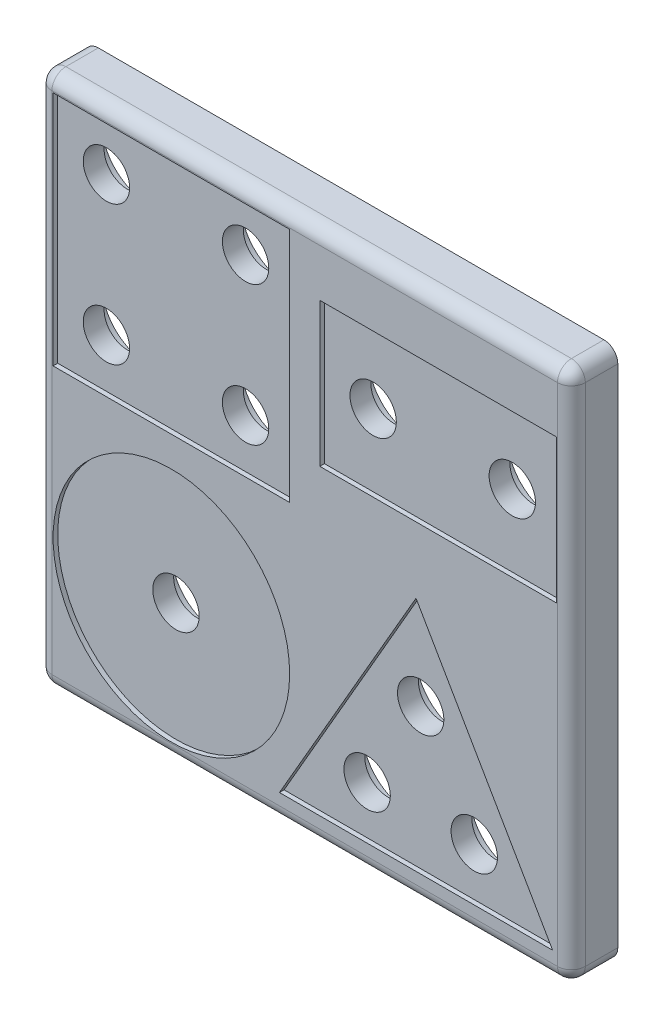
from build123d import *

# Parameters (mm, degrees)
SKETCH1_W           = 115
SKETCH1_H           = 115
BOSS_EXTRUDE1_DEPTH = 10
SKETCH2_W           = 51
SKETCH2_H           = 51
CUT_EXTRUDE1_DEPTH  = 1
SKETCH4_W           = 51
SKETCH4_H           = 31
CUT_EXTRUDE2_DEPTH  = 1
SKETCH11_R          = 25.5
SKETCH11_R_2        = 5
CUT_EXTRUDE8_DEPTH  = 1
SKETCH6_R           = 5
CUT_EXTRUDE9_DEPTH  = 1
SKETCH3_R           = 5
CUT_EXTRUDE10_DEPTH = 10
SKETCH5_R           = 5
CUT_EXTRUDE11_DEPTH = 10
SKETCH19_R          = 5
CUT_EXTRUDE12_DEPTH = 10
SKETCH20_R          = 5
CUT_EXTRUDE13_DEPTH = 10
SKETCH21_R          = 10
CUT_EXTRUDE14_DEPTH = 4.5
FILLET2_R           = 3


with BuildPart() as part:
    # Sketch1 → Boss-Extrude1 (new body)
    with BuildSketch(Plane.XY):
        Rectangle(SKETCH1_W, SKETCH1_H)
    extrude(amount=BOSS_EXTRUDE1_DEPTH)

    # Sketch2 → Cut-Extrude1 (cut)
    with BuildSketch(Plane.XY.offset(10)):
        with Locations((-28.75, 28.75)):
            Rectangle(SKETCH2_W, SKETCH2_H)
    extrude(amount=-CUT_EXTRUDE1_DEPTH, mode=Mode.SUBTRACT)

    # Sketch4 → Cut-Extrude2 (cut)
    with BuildSketch(Plane.XY.offset(10)):
        with Locations((28.75, 28.75)):
            Rectangle(SKETCH4_W, SKETCH4_H)
    extrude(amount=-CUT_EXTRUDE2_DEPTH, mode=Mode.SUBTRACT)

    # Sketch11 → Cut-Extrude8 (cut)
    with BuildSketch(Plane.XY.offset(10)):
        with Locations((-28.75, -28.75)):
            Circle(SKETCH11_R)
        with Locations((-28.75, -28.75)):
            Circle(SKETCH11_R_2, mode=Mode.SUBTRACT)
    extrude(amount=-CUT_EXTRUDE8_DEPTH, mode=Mode.SUBTRACT)

    # Sketch6 → Cut-Extrude9 (cut)
    with BuildSketch(Plane.XY.offset(10)):
        Polygon((24, -1), (-5.444863729, -52), (53.444863729, -52), align=None)
        with Locations((24, -21.666666667)):
            Circle(SKETCH6_R, mode=Mode.SUBTRACT)
        with Locations((35.547005384, -41.666666667)):
            Circle(SKETCH6_R, mode=Mode.SUBTRACT)
        with Locations((12.452994616, -41.666666667)):
            Circle(SKETCH6_R, mode=Mode.SUBTRACT)
    extrude(amount=-CUT_EXTRUDE9_DEPTH, mode=Mode.SUBTRACT)

    # Sketch3 → Cut-Extrude10 (cut)
    with BuildSketch(Plane.XY.offset(9)):
        with Locations((-43.75, 43.75)):
            Circle(SKETCH3_R)
        with Locations((-13.75, 43.75)):
            Circle(SKETCH3_R)
        with Locations((-13.75, 13.75)):
            Circle(SKETCH3_R)
        with Locations((-43.75, 13.75)):
            Circle(SKETCH3_R)
    extrude(amount=-CUT_EXTRUDE10_DEPTH, mode=Mode.SUBTRACT)

    # Sketch5 → Cut-Extrude11 (cut)
    with BuildSketch(Plane.XY.offset(9)):
        with Locations((13.75, 28.75)):
            Circle(SKETCH5_R)
        with Locations((43.75, 28.75)):
            Circle(SKETCH5_R)
    extrude(amount=-CUT_EXTRUDE11_DEPTH, mode=Mode.SUBTRACT)

    # Sketch19 → Cut-Extrude12 (cut)
    with BuildSketch(Plane.XY.offset(10)):
        with Locations((-28.75, -28.75)):
            Circle(SKETCH19_R)
    extrude(amount=-CUT_EXTRUDE12_DEPTH, mode=Mode.SUBTRACT)

    # Sketch20 → Cut-Extrude13 (cut)
    with BuildSketch(Plane.XY.offset(10)):
        with Locations((24, -21.666666667)):
            Circle(SKETCH20_R)
        with Locations((35.547005384, -41.666666667)):
            Circle(SKETCH20_R)
        with Locations((12.452994616, -41.666666667)):
            Circle(SKETCH20_R)
    extrude(amount=-CUT_EXTRUDE13_DEPTH, mode=Mode.SUBTRACT)

    # Sketch21 → Cut-Extrude14 (cut)
    with BuildSketch(Plane(origin=(0, 0, 0), x_dir=(-1, 0, 0), z_dir=(0, 0, -1))):
        with Locations((-43.75, 28.75)):
            Circle(SKETCH21_R)
        with Locations((-13.75, 28.75)):
            Circle(SKETCH21_R)
        with Locations((13.75, 43.75)):
            Circle(SKETCH21_R)
        with Locations((43.75, 43.75)):
            Circle(SKETCH21_R)
        with Locations((43.75, 13.75)):
            Circle(SKETCH21_R)
        with Locations((13.75, 13.75)):
            Circle(SKETCH21_R)
        with Locations((-24, -21.666666667)):
            Circle(SKETCH21_R)
        with Locations((28.75, -28.75)):
            Circle(SKETCH21_R)
        with Locations((-12.452994616, -41.666666667)):
            Circle(SKETCH21_R)
        with Locations((-35.547005384, -41.666666667)):
            Circle(SKETCH21_R)
    extrude(amount=-CUT_EXTRUDE14_DEPTH, mode=Mode.SUBTRACT)

    # Fillet2
    fillet2_edges = [part.edges().sort_by_distance(p)[0] for p in [
        (57.5, 0, 10),
        (0, 57.5, 10),
        (-57.5, 0, 10),
        (0, -57.5, 10),
        (-57.5, 57.5, 5),
        (57.5, 57.5, 5),
        (57.5, -57.5, 5),
        (-57.5, -57.5, 5),
    ]]
    fillet(fillet2_edges, radius=FILLET2_R)


solid = part.part
